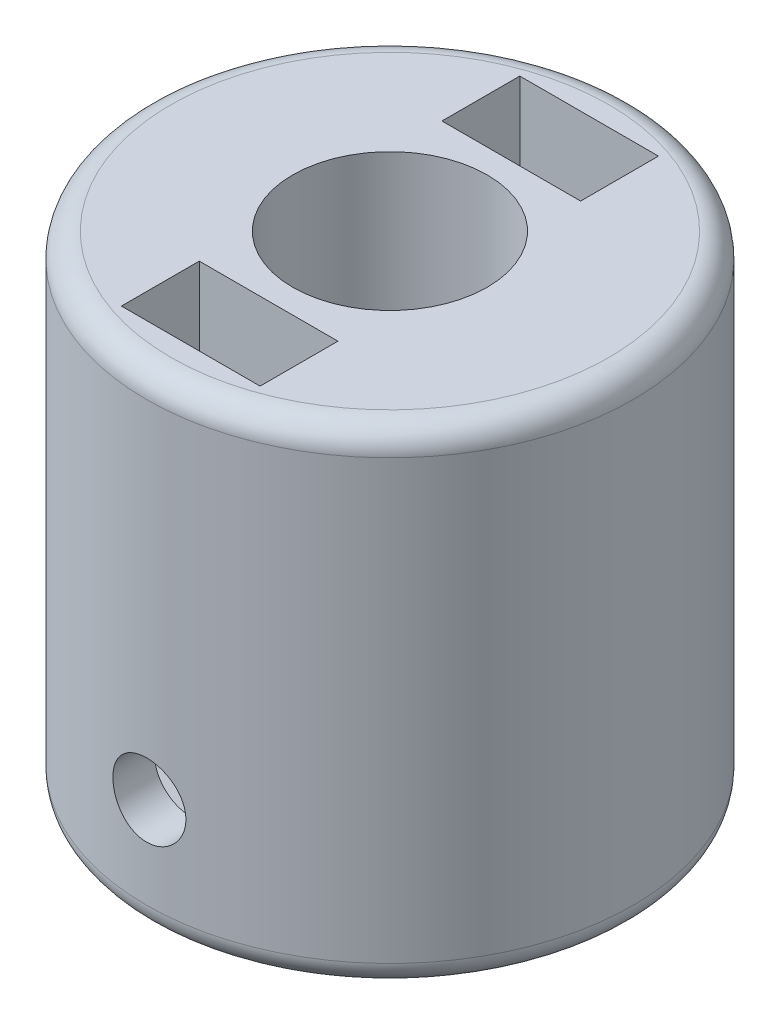
from build123d import *

# Parameters (mm, degrees)
SKETCH1_R           = 10
SKETCH1_R_2         = 3.175
BOSS_EXTRUDE1_DEPTH = 20
SKETCH2_W           = 5.7
SKETCH2_H           = 3.2
CUT_EXTRUDE1_DEPTH  = 17
CUT_EXTRUDE2_DEPTH  = 3.3
SKETCH4_R           = 4
CUT_EXTRUDE3_DEPTH  = 9.3
SKETCH5_W           = 5.7
SKETCH5_H           = 3.2
CUT_EXTRUDE5_DEPTH  = 7.8
CUT_EXTRUDE6_DEPTH  = 3.2
FILLET1_R           = 1
SKETCH7_R           = 1.5
CUT_EXTRUDE7_DEPTH  = 10.2
SKETCH8_R           = 1.5
CUT_EXTRUDE8_DEPTH  = 7.2


with BuildPart() as part:
    # Sketch1 → Boss-Extrude1 (new body)
    with BuildSketch(Plane(origin=(0, 0, 0), x_dir=(1, 0, 0), z_dir=(0, 1, 0))):
        with Locations(Location((0, 0, 0), (0, 0, 270))):
            Circle(SKETCH1_R)
        with Locations(Location((0, 0, 0), (0, 0, 270))):
            Circle(SKETCH1_R_2, mode=Mode.SUBTRACT)
    extrude(amount=BOSS_EXTRUDE1_DEPTH)

    # Sketch2 → Cut-Extrude1 (cut)
    with BuildSketch(Plane(origin=(0, 20, 0), x_dir=(1, 0, 0), z_dir=(0, 1, 0))):
        with Locations((0, -6.5875)):
            Rectangle(SKETCH2_W, SKETCH2_H)
    extrude(amount=-CUT_EXTRUDE1_DEPTH, mode=Mode.SUBTRACT)

    # Sketch3 → Cut-Extrude2 (cut)
    with BuildSketch(Plane.XY.offset(4.9875)):
        Polygon((-2.85, 3), (0, 1.451324557), (2.85, 3), align=None)
    extrude(amount=CUT_EXTRUDE2_DEPTH, mode=Mode.SUBTRACT)

    # Sketch4 → Cut-Extrude3 (cut)
    with BuildSketch(Plane(origin=(0, 20, 0), x_dir=(1, 0, 0), z_dir=(0, 1, 0))):
        with Locations(Location((0, 0, 0), (0, 0, 270))):
            Circle(SKETCH4_R)
    extrude(amount=-CUT_EXTRUDE3_DEPTH, mode=Mode.SUBTRACT)

    # Sketch5 → Cut-Extrude5 (cut)
    with BuildSketch(Plane(origin=(0, 20, 0), x_dir=(1, 0, 0), z_dir=(0, 1, 0))):
        with Locations((0, 6.5875)):
            Rectangle(SKETCH5_W, SKETCH5_H)
    extrude(amount=-CUT_EXTRUDE5_DEPTH, mode=Mode.SUBTRACT)

    # Sketch6 → Cut-Extrude6 (cut)
    with BuildSketch(Plane(origin=(0, 0, -4.9875), x_dir=(-1, 0, 0), z_dir=(0, 0, -1))):
        Polygon((-2.85, 12.2), (0, 10.7), (2.85, 12.2), align=None)
    extrude(amount=CUT_EXTRUDE6_DEPTH, mode=Mode.SUBTRACT)

    # Fillet1
    fillet1_edges = [part.edges().sort_by_distance(p)[0] for p in [
        (0, 0, -10),
        (0, 20, -10),
    ]]
    fillet(fillet1_edges, radius=FILLET1_R)

    # Sketch7 → Cut-Extrude7 (cut)
    with BuildSketch(Plane(origin=(0, 0, -4.9875), x_dir=(-1, 0, 0), z_dir=(0, 0, -1))):
        with Locations(Location((0, 13.836807089, 0), (0, 0, 90))):
            Circle(SKETCH7_R)
    extrude(amount=CUT_EXTRUDE7_DEPTH, mode=Mode.SUBTRACT)

    # Sketch8 → Cut-Extrude8 (cut)
    with BuildSketch(Plane.XY.offset(4.9875)):
        with Locations(Location((0, 4.748303772, 0), (0, 0, 180))):
            Circle(SKETCH8_R)
    extrude(amount=CUT_EXTRUDE8_DEPTH, mode=Mode.SUBTRACT)


solid = part.part
